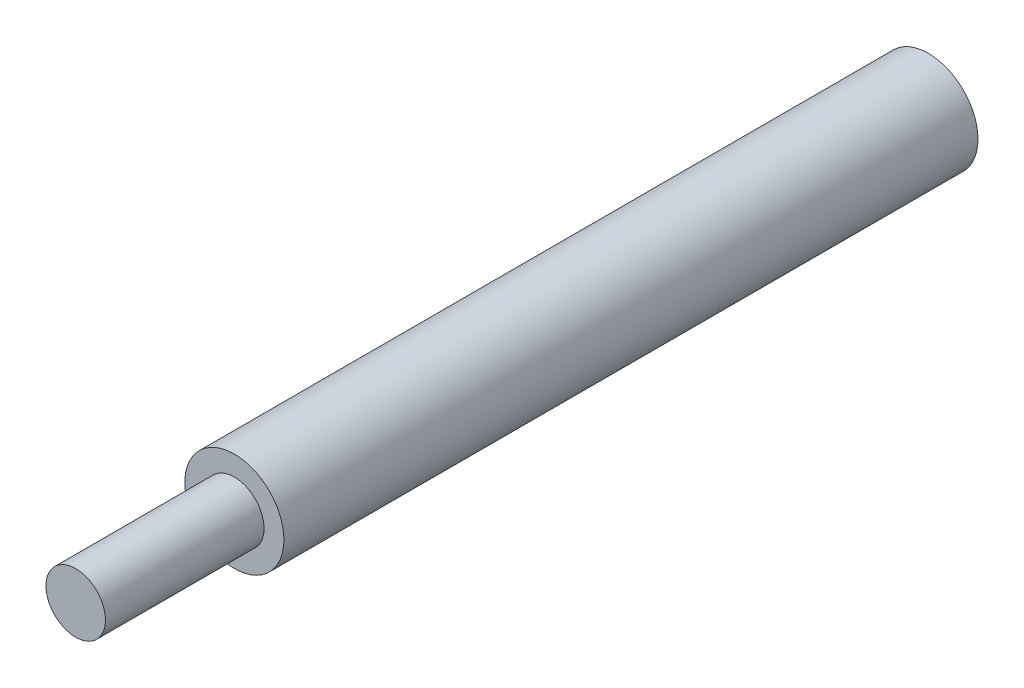
from build123d import *

# Parameters (mm, degrees)
SKETCH1_R           = 2.5
BOSS_EXTRUDE1_DEPTH = 35
SKETCH2_R           = 1.5
BOSS_EXTRUDE2_DEPTH = 8


with BuildPart() as part:
    # Sketch1 → Boss-Extrude1 (new body)
    with BuildSketch(Plane.XY):
        Circle(SKETCH1_R)
    extrude(amount=BOSS_EXTRUDE1_DEPTH)

    # Sketch2 → Boss-Extrude2 (add)
    with BuildSketch(Plane.XY.offset(35)):
        Circle(SKETCH2_R)
    extrude(amount=BOSS_EXTRUDE2_DEPTH)


solid = part.part
